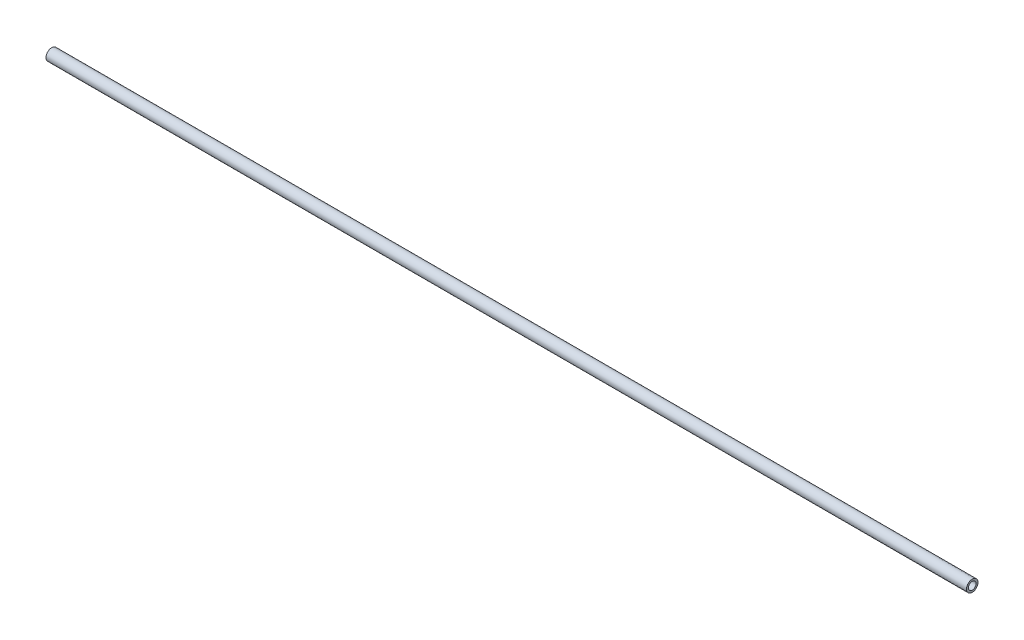
from build123d import *

# Parameters (mm, degrees)
SKETCH1_R      = 9.525
SKETCH1_R_2    = 6.35
EXTRUDE1_DEPTH = 762


with BuildPart() as part:
    # Sketch1 → Extrude1 (new, symmetric)
    with BuildSketch(Plane(origin=(0, 0, 0), x_dir=(0, 0, -1), z_dir=(1, 0, 0))):
        Circle(SKETCH1_R)
        Circle(SKETCH1_R_2, mode=Mode.SUBTRACT)
    extrude(amount=EXTRUDE1_DEPTH, both=True)


solid = part.part
